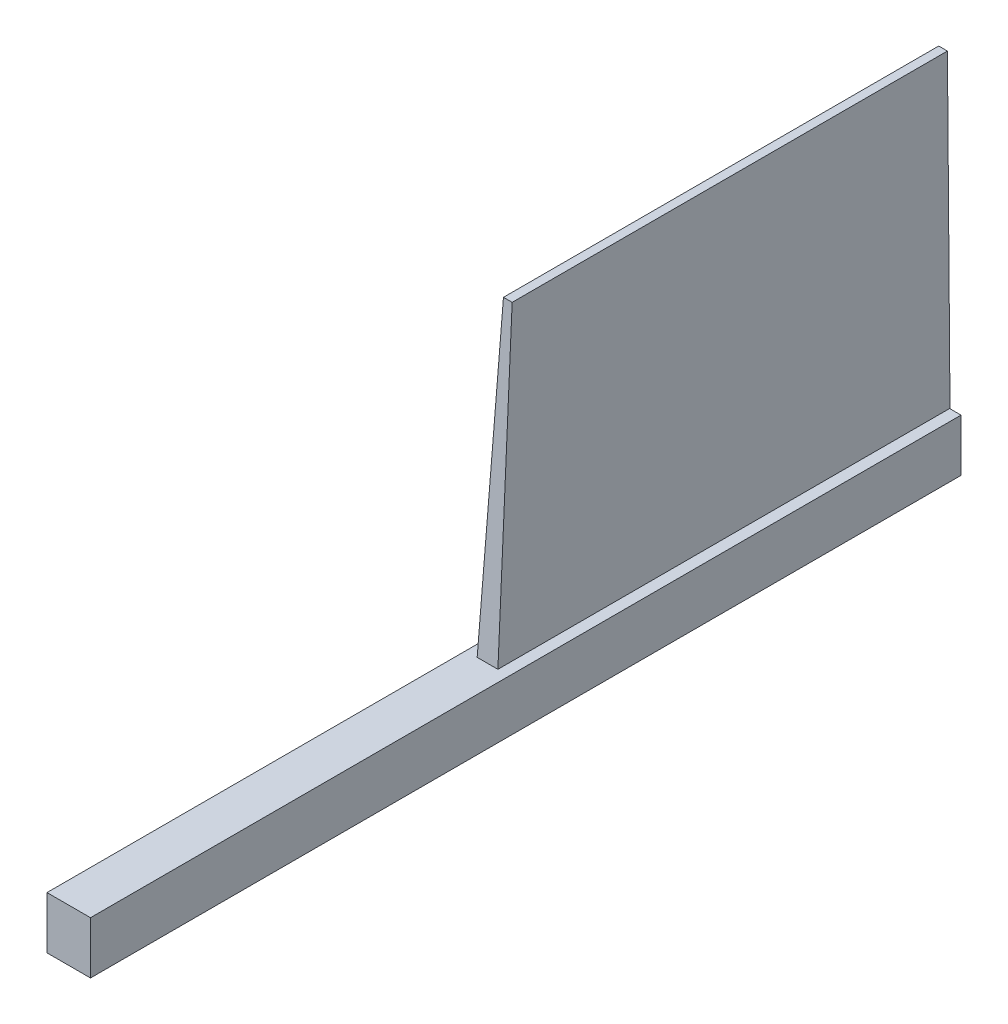
from build123d import *

# Parameters (mm, degrees)
ESQUISSE1_W        = 10
ESQUISSE1_H        = 12
BOSS_EXTRU_1_DEPTH = 200


with BuildPart() as part:
    # Esquisse1 → Boss.-Extru.1 (new body)
    with BuildSketch(Plane.XY):
        Rectangle(ESQUISSE1_W, ESQUISSE1_H)
    extrude(amount=BOSS_EXTRU_1_DEPTH)

    # Esquisse4 → Lissage2 section 0
    with BuildSketch(Plane(origin=(0, 0, 0), x_dir=(1, 0, 0), z_dir=(0, 1, 0))):
        with BuildLine():
            Line((-2.5, 0.020027966), (2.5, 0.020027966))
            Line((2.5, 0.020027966), (2.5, -104.18332506))
            Line((2.5, -104.18332506), (-2.5, -104.18332506))
            Line((-2.5, -104.18332506), (-2.5, 0.020027966))
        make_face()
    # Esquisse3 → Lissage2 section 1
    with BuildSketch(Plane(origin=(0, 76, 0), x_dir=(1, 0, 0), z_dir=(0, 1, 0))):
        with BuildLine():
            Line((-1, 0.876103951), (1, 0.876103951))
            Line((1, 0.876103951), (1, -99.123896049))
            Line((1, -99.123896049), (-1, -99.123896049))
            Line((-1, -99.123896049), (-1, 0.876103951))
        make_face()
    loft()


solid = part.part
